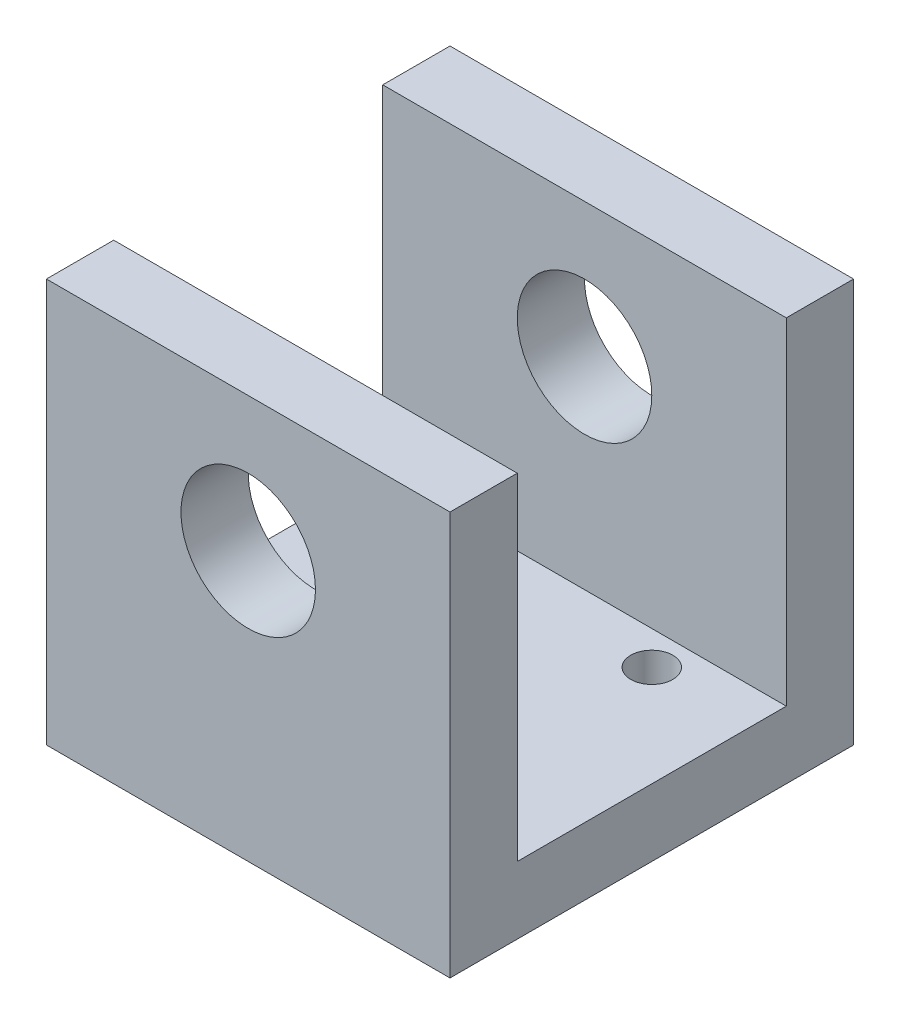
from build123d import *

# Parameters (mm, degrees)
BOSS_EXTRUDE1_DEPTH            = 76.2
SKETCH2_R                      = 12.7
CUT_EXTRUDE1_DEPTH             = 132.982271537
F_5_16_0_3125_DIAMETER_HOLE1_D = 7.9375
LPATTERN1_COUNT                = 2
LPATTERN1_PITCH                = 38.1
LPATTERN1_COUNT_DIR2           = 2
LPATTERN1_PITCH_DIR2           = 38.1


with BuildPart() as part:
    # Sketch1 → Boss-Extrude1 (new body)
    with BuildSketch(Plane(origin=(0, 0, 0), x_dir=(0, 0, -1), z_dir=(1, 0, 0))):
        Polygon((0, 0), (76.2, 0), (76.2, 76.2), (63.5, 76.2), (63.5, 12.7), (12.7, 12.7), (12.7, 76.2), (0, 76.2), align=None)
    extrude(amount=BOSS_EXTRUDE1_DEPTH)

    # Sketch2 → Cut-Extrude1 (cut, through all)
    with BuildSketch(Plane.XY):
        with Locations((38.1, 50.8)):
            Circle(SKETCH2_R)
    extrude(amount=-CUT_EXTRUDE1_DEPTH, mode=Mode.SUBTRACT)

    # 5/16 (0.3125) Diameter Hole1 (through all)
    with Locations(Plane(origin=(0, 12.7, 0), x_dir=(1, 0, 0), z_dir=(0, 1, 0))):
        with Locations((19.05, 19.05)):
            f_5_16_0_3125_diameter_hole1 = Hole(F_5_16_0_3125_DIAMETER_HOLE1_D / 2)

    # LPattern1: 5_16 _0.3125_ Diameter Hole1 2 × 2
    with Locations(*[(i * LPATTERN1_PITCH, 0, -j * LPATTERN1_PITCH_DIR2) for i in range(LPATTERN1_COUNT) for j in range(LPATTERN1_COUNT_DIR2) if (i, j) != (0, 0)]):
        add(f_5_16_0_3125_diameter_hole1, mode=Mode.SUBTRACT)


solid = part.part
